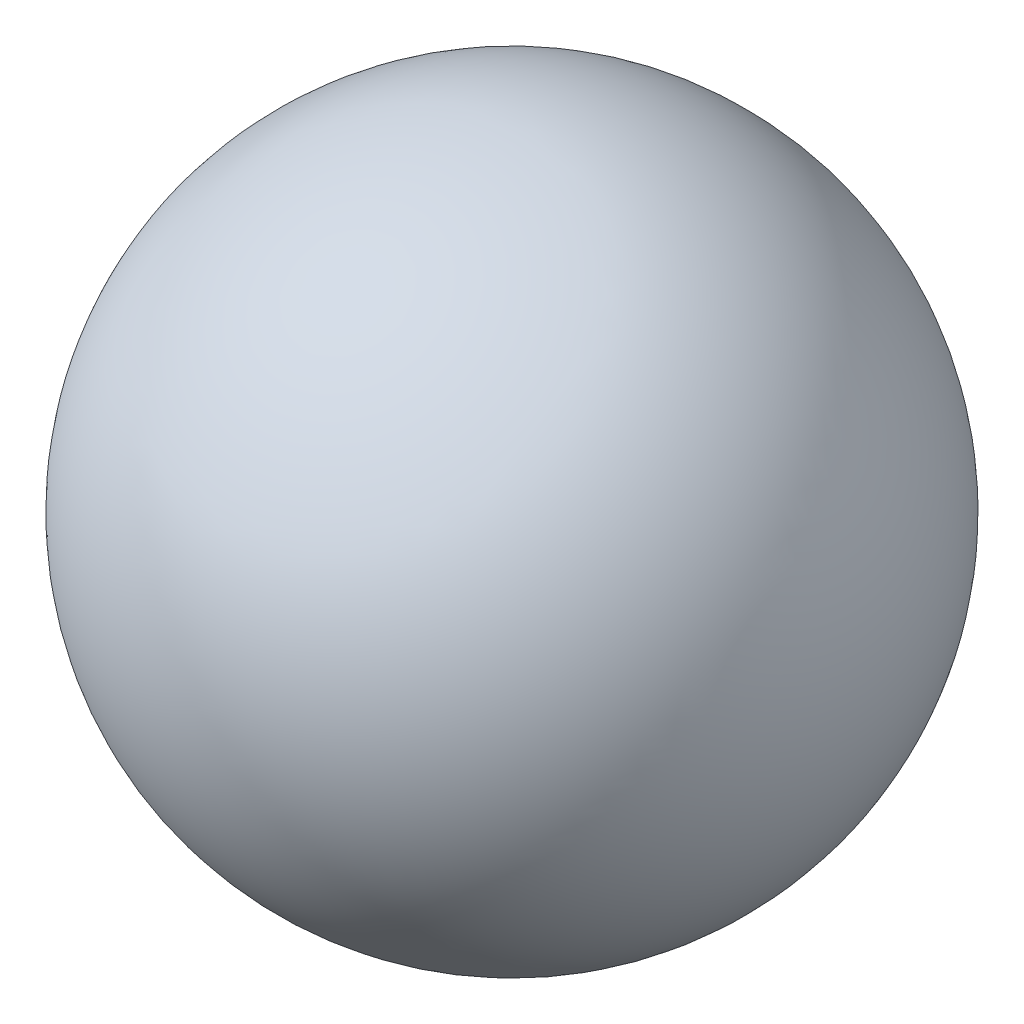
from build123d import *


with BuildPart() as part:
    # 草图2 → 旋转4 (revolve)
    with BuildSketch(Plane.XY):
        with BuildLine():
            Line((-21.25, 0), (21.25, 0))
            ThreePointArc((21.25, 0), (0, -21.25), (-21.25, 0))
        make_face()
    revolve(axis=Axis((-21.25, 0, 0), (1, 0, 0)))


solid = part.part
